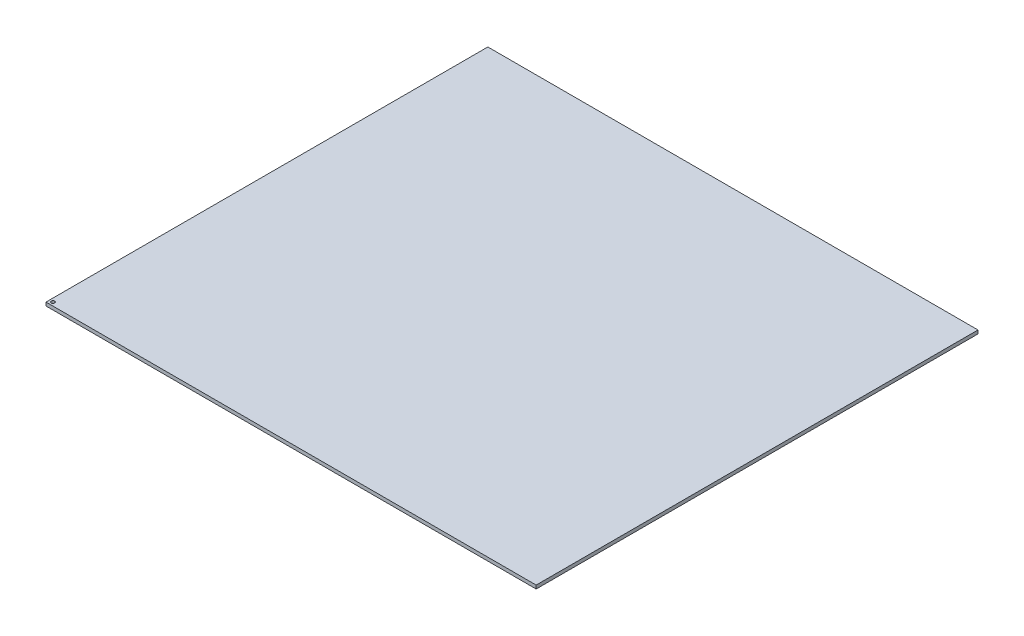
from build123d import *

# Parameters (mm, degrees)
SKETCH1_W           = 901.7
SKETCH1_H           = 812.8
BOSS_EXTRUDE1_DEPTH = 3.175
SKETCH2_R           = 3.175
CUT_EXTRUDE1_DEPTH  = 608.014830956


with BuildPart() as part:
    # Sketch1 → Boss-Extrude1 (new, symmetric)
    with BuildSketch(Plane(origin=(0, 0, 0), x_dir=(1, 0, 0), z_dir=(0, 1, 0))):
        Rectangle(SKETCH1_W, SKETCH1_H)
    extrude(amount=BOSS_EXTRUDE1_DEPTH, both=True)

    # Sketch2 → Cut-Extrude1 (cut, through all)
    with BuildSketch(Plane(origin=(0, 3.175, 0), x_dir=(1, 0, 0), z_dir=(0, 1, 0))):
        with Locations(Location((-444.5, -400.05, 0), (0, 0, 270))):
            Circle(SKETCH2_R)
    extrude(amount=-CUT_EXTRUDE1_DEPTH, mode=Mode.SUBTRACT)


solid = part.part
